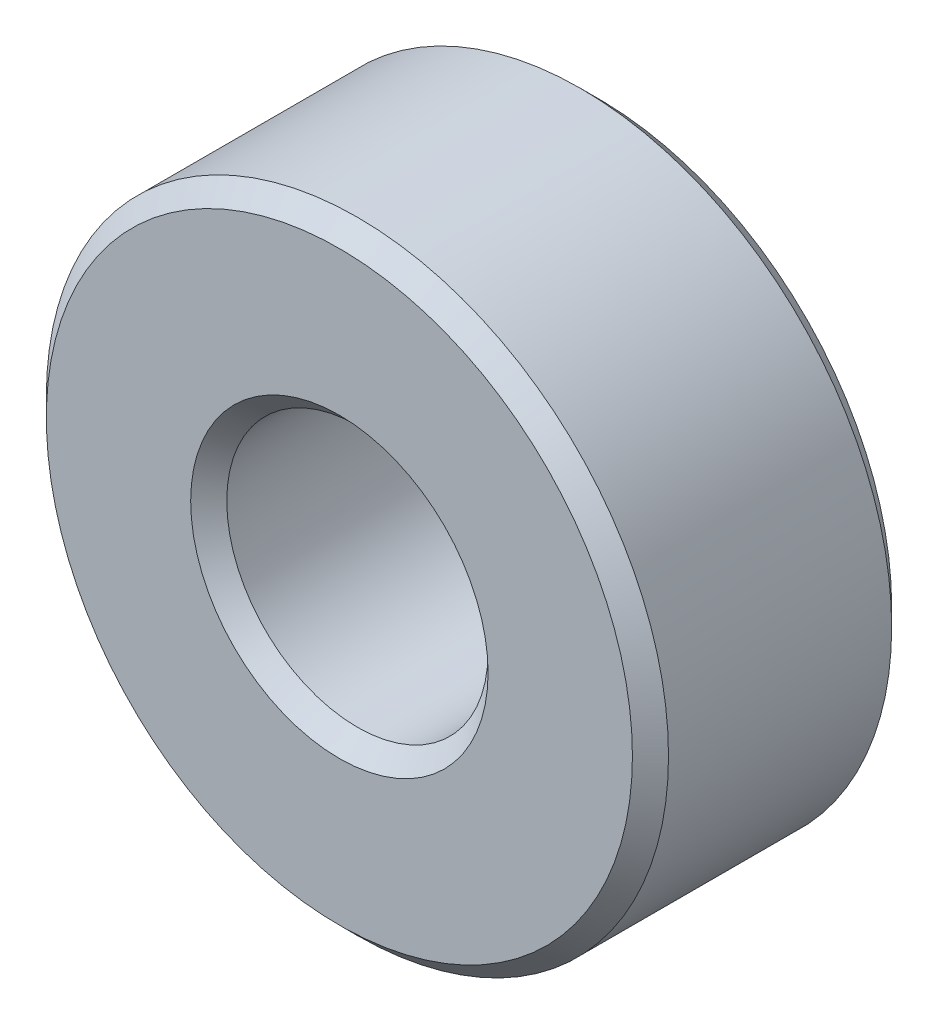
from build123d import *

# Parameters (mm, degrees)
BOSS_EXTRUDE1_DEPTH      = 3.96875
BOSS_EXTRUDE1_DEPTH_BACK = 3.96875
SKETCH3_R                = 9.525
SKETCH3_R_2              = 4.0005
CHAMFER1_SIZE            = 0.55245


with BuildPart() as part:
    # Sketch3 → Boss-Extrude1 (new, two sides: drawn at the far end of the back side and taken through both)
    with BuildSketch(Plane.XY.offset(-BOSS_EXTRUDE1_DEPTH_BACK)):
        Circle(SKETCH3_R)
        Circle(SKETCH3_R_2, mode=Mode.SUBTRACT)
    extrude(amount=BOSS_EXTRUDE1_DEPTH + BOSS_EXTRUDE1_DEPTH_BACK)

    # Chamfer1
    chamfer1_edges = [part.edges().sort_by_distance(p)[0] for p in [
        (-9.525, 0, -3.96875),
        (-4.0005, 0, -3.96875),
        (-9.525, 0, 3.96875),
        (-4.0005, 0, 3.96875),
    ]]
    chamfer(chamfer1_edges, length=CHAMFER1_SIZE)


solid = part.part
